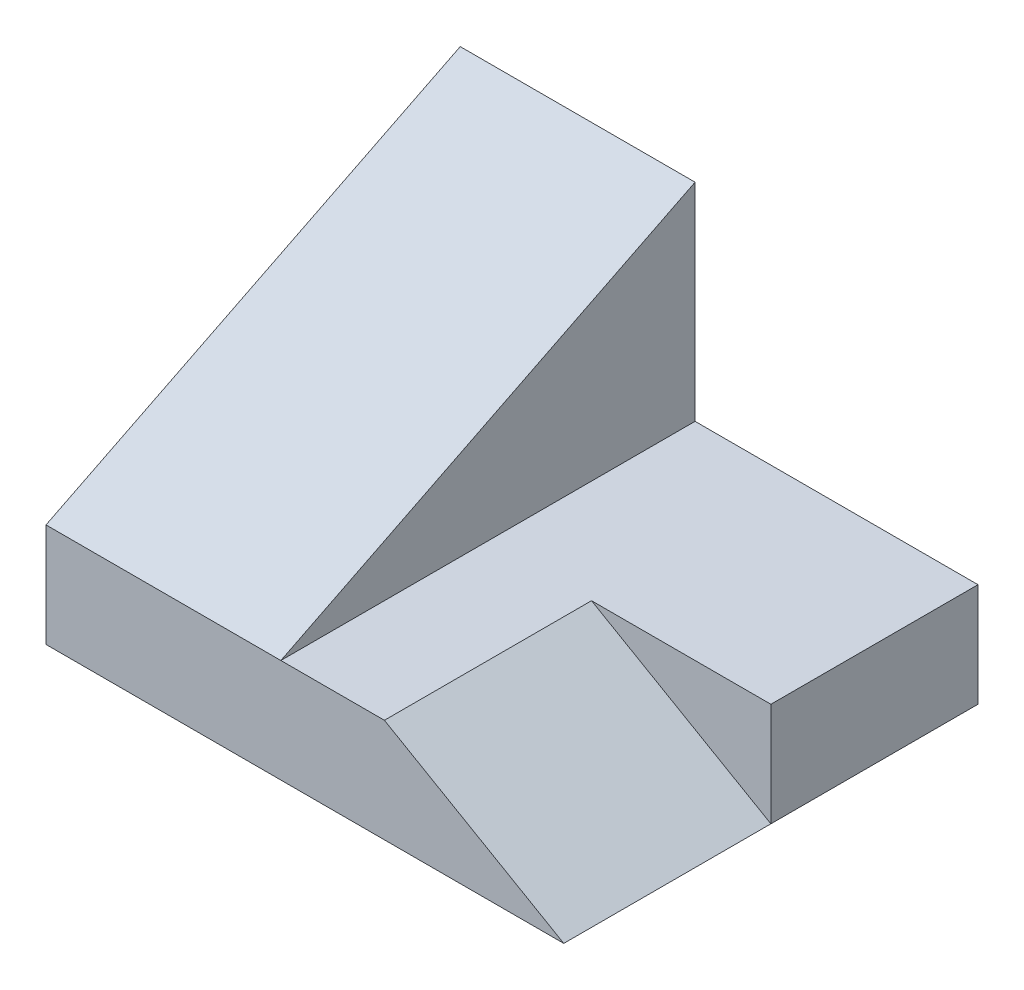
from build123d import *

# Parameters (mm, degrees)
SKETCH2_W           = 50
SKETCH2_H           = 40
BOSS_EXTRUDE1_DEPTH = 10
CUT_EXTRUDE4_DEPTH  = 20
SKETCH6_W           = 22.679491924
SKETCH6_H           = 40
BOSS_EXTRUDE3_DEPTH = 20
CUT_EXTRUDE9_DEPTH  = 30


with BuildPart() as part:
    # Sketch2 → Boss-Extrude1 (new body)
    with BuildSketch(Plane(origin=(0, 0, 0), x_dir=(1, 0, 0), z_dir=(0, 1, 0))):
        with Locations((25, 20)):
            Rectangle(SKETCH2_W, SKETCH2_H)
    extrude(amount=BOSS_EXTRUDE1_DEPTH)

    # Sketch4 → Cut-Extrude4 (cut)
    with BuildSketch(Plane.XY):
        Polygon((32.679491924, 10), (50, 0), (50, 10), align=None)
    extrude(amount=-CUT_EXTRUDE4_DEPTH, mode=Mode.SUBTRACT)

    # Sketch6 → Boss-Extrude3 (add)
    with BuildSketch(Plane(origin=(0, 10, 0), x_dir=(1, 0, 0), z_dir=(0, 1, 0))):
        with Locations((11.339745962, 20)):
            Rectangle(SKETCH6_W, SKETCH6_H)
    extrude(amount=BOSS_EXTRUDE3_DEPTH)

    # Sketch8 → Cut-Extrude9 (cut)
    with BuildSketch(Plane(origin=(22.679491924, 0, 0), x_dir=(0, 0, -1), z_dir=(1, 0, 0))):
        Polygon((40, 30), (0, 10), (0, 30), align=None)
    extrude(amount=-CUT_EXTRUDE9_DEPTH, mode=Mode.SUBTRACT)


solid = part.part
